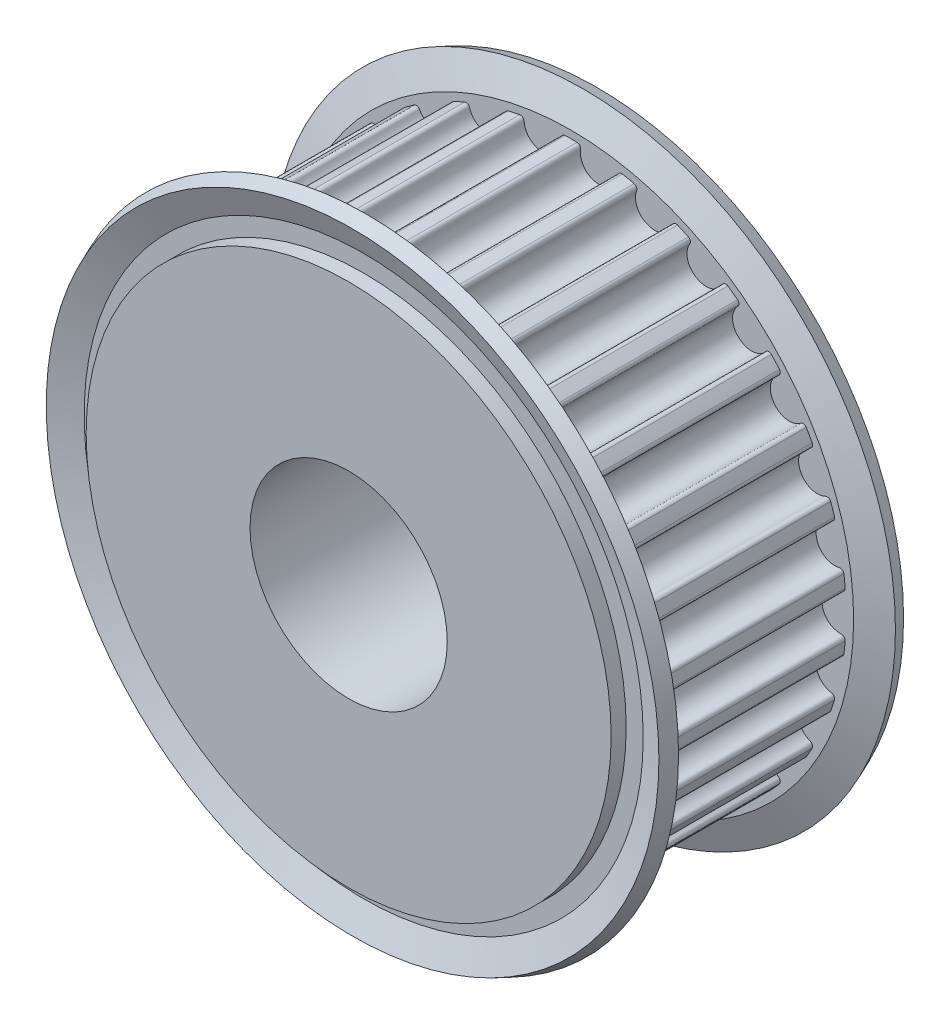
from build123d import *

# Parameters (mm, degrees)
TOOTHEXTRUDECUTGEARBELT01_DEPTH = 4.876799927
PATTERNGEARBELT01_COUNT         = 30
BOREREVOLVESKETCH_W             = 12.801599808
BOREREVOLVESKETCH_H             = 5


with BuildPart() as part:
    # SketchRevolveGearBelt01 → GearBelt01 (revolve)
    with BuildSketch(Plane(origin=(0, 0, 0), x_dir=(0, 0, -1), z_dir=(1, 0, 0)), mode=Mode.PRIVATE) as gearbelt01_sk:
        Polygon((6.400799904, 0), (6.400799904, 13.306916417), (5.638799915, 13.306916417), (5.638799915, 14.17134518), (6.201536555, 15.529911608), (5.497540362, 15.821516379), (4.876799927, 14.322916402), (4.876799927, 13.941916408), (-4.876799927, 13.941916408), (-4.876799927, 14.322916402), (-5.497540362, 15.821516379), (-6.201536555, 15.529911608), (-5.638799915, 14.17134518), (-5.638799915, 13.306916417), (-6.400799904, 13.306916417), (-6.400799904, 0), align=None)
    revolve(gearbelt01_sk.sketch.rotate(Axis((0, 0, 0), (0, 0, -1)), 90), axis=Axis((0, 0, 0), (0, 0, -1)))

    # SketchToothGearBelt01 → ToothExtrudeCutGearBelt01 (cut, symmetric)
    with BuildSketch(Plane.XY):
        with BuildLine():
            ThreePointArc((13.893477895, 1.162049767), (13.941990091, 0), (13.893477895, -1.162049767))
            add(Edge.make_bspline(
                [(13.893477895, -1.162049767), (13.894355497, -1.151569871), (13.894367328, -1.13574137), (13.891783851, -1.114849561), (13.88856033, -1.099393952), (13.884072736, -1.084256956), (13.878351699, -1.069541767), (13.871436211, -1.055348702), (13.863373419, -1.041774518), (13.854218288, -1.028911755), (13.844033233, -1.016848102), (13.832887687, -1.005665799), (13.820857633, -0.995441086), (13.808025082, -0.986243636), (13.794477517, -0.97813627), (13.780307299, -0.971173811), (13.765611019, -0.965405397), (13.750488906, -0.960864109), (13.735043897, -0.957604207), (13.719381867, -0.955560951), (13.690295039, -0.954660893), (13.642257342, -0.955570539), (13.575220239, -0.952960995), (13.502997829, -0.944194093), (13.431675895, -0.929863568), (13.361697972, -0.909971895), (13.293492773, -0.884664268), (13.227479874, -0.85409009), (13.164064907, -0.818438922), (13.10363766, -0.777929443), (13.046569525, -0.732810753), (12.993211261, -0.683360129), (12.943890814, -0.629881514), (12.898911329, -0.572703598), (12.858549229, -0.512177812), (12.823052703, -0.448676153), (12.792639493, -0.382588943), (12.767498123, -0.314322274), (12.747777154, -0.244296081), (12.733620052, -0.172939446), (12.725030771, -0.100695851), (12.723087585, -0.04755736), (12.723178891, -0.014000083), (12.723166194, 0), (12.723178891, 0.014000083), (12.723087585, 0.04755736), (12.725030771, 0.100695851), (12.733620052, 0.172939446), (12.747777154, 0.244296081), (12.767498123, 0.314322274), (12.792639493, 0.382588943), (12.823052703, 0.448676153), (12.858549229, 0.512177812), (12.898911329, 0.572703598), (12.943890814, 0.629881514), (12.993211261, 0.683360129), (13.046569525, 0.732810753), (13.10363766, 0.777929443), (13.164064907, 0.818438922), (13.227479874, 0.85409009), (13.293492773, 0.884664268), (13.361697972, 0.909971895), (13.431675895, 0.929863568), (13.502997829, 0.944194093), (13.575220239, 0.952960995), (13.642257342, 0.955570539), (13.690295039, 0.954660893), (13.719381867, 0.955560951), (13.735043897, 0.957604207), (13.750488906, 0.960864109), (13.765611019, 0.965405397), (13.780307299, 0.971173811), (13.794477517, 0.97813627), (13.808025082, 0.986243636), (13.820857633, 0.995441086), (13.832887687, 1.005665799), (13.844033233, 1.016848102), (13.854218288, 1.028911755), (13.863373419, 1.041774518), (13.871436211, 1.055348702), (13.878351699, 1.069541767), (13.884072736, 1.084256956), (13.88856033, 1.099393952), (13.891783851, 1.114849561), (13.894367328, 1.13574137), (13.894355497, 1.151569871), (13.893477895, 1.162049767)],
                knots=[0, 0, 0, 0, 0.008512506, 0.012768759, 0.017025012, 0.021281265, 0.025537518, 0.029793771, 0.034050023, 0.038306276, 0.042562529, 0.046818782, 0.051075035, 0.055331288, 0.059587541, 0.063843794, 0.068100047, 0.0723563, 0.076612553, 0.080868806, 0.085125059, 0.100157118, 0.119771414, 0.139385711, 0.159000007, 0.178614304, 0.1982286, 0.217842897, 0.237457193, 0.257071489, 0.276685786, 0.296300082, 0.315914379, 0.335528675, 0.355142972, 0.374757268, 0.394371565, 0.413985861, 0.433600158, 0.453214454, 0.472828751, 0.492443047, 0.496221523, 0.5, 0.503778477, 0.507556953, 0.527171249, 0.546785546, 0.566399842, 0.586014139, 0.605628435, 0.625242732, 0.644857028, 0.664471325, 0.684085621, 0.703699918, 0.723314214, 0.742928511, 0.762542807, 0.782157103, 0.8017714, 0.821385696, 0.840999993, 0.860614289, 0.880228586, 0.899842882, 0.914874941, 0.919131194, 0.923387447, 0.9276437, 0.931899953, 0.936156206, 0.940412459, 0.944668712, 0.948924965, 0.953181218, 0.957437471, 0.961693724, 0.965949977, 0.970206229, 0.974462482, 0.978718735, 0.982974988, 0.987231241, 0.991487494, 1, 1, 1, 1], degree=3))
        make_face()
    toothextrudecutgearbelt01 = extrude(amount=TOOTHEXTRUDECUTGEARBELT01_DEPTH, both=True, mode=Mode.SUBTRACT)

    # PatternGearBelt01: ToothExtrudeCutGearBelt01 ×30 about axis
    patterngearbelt01_axis = Axis((0, 0, 55), (0, 0, -1))
    for i in range(1, PATTERNGEARBELT01_COUNT):
        add(toothextrudecutgearbelt01.rotate(patterngearbelt01_axis, i * 360 / PATTERNGEARBELT01_COUNT), mode=Mode.SUBTRACT)

    # BoreRevolveSketch → BoreRevolveCut (revolve, cut)
    with BuildSketch(Plane(origin=(0, 0, 0), x_dir=(0, 0, -1), z_dir=(1, 0, 0)), mode=Mode.PRIVATE) as borerevolvecut_sk:
        with Locations((0, 2.5)):
            Rectangle(BOREREVOLVESKETCH_W, BOREREVOLVESKETCH_H)
    revolve(borerevolvecut_sk.sketch.rotate(Axis((0, 0, 0), (0, 0, -1)), 90), axis=Axis((0, 0, 0), (0, 0, -1)), mode=Mode.SUBTRACT)


solid = part.part
